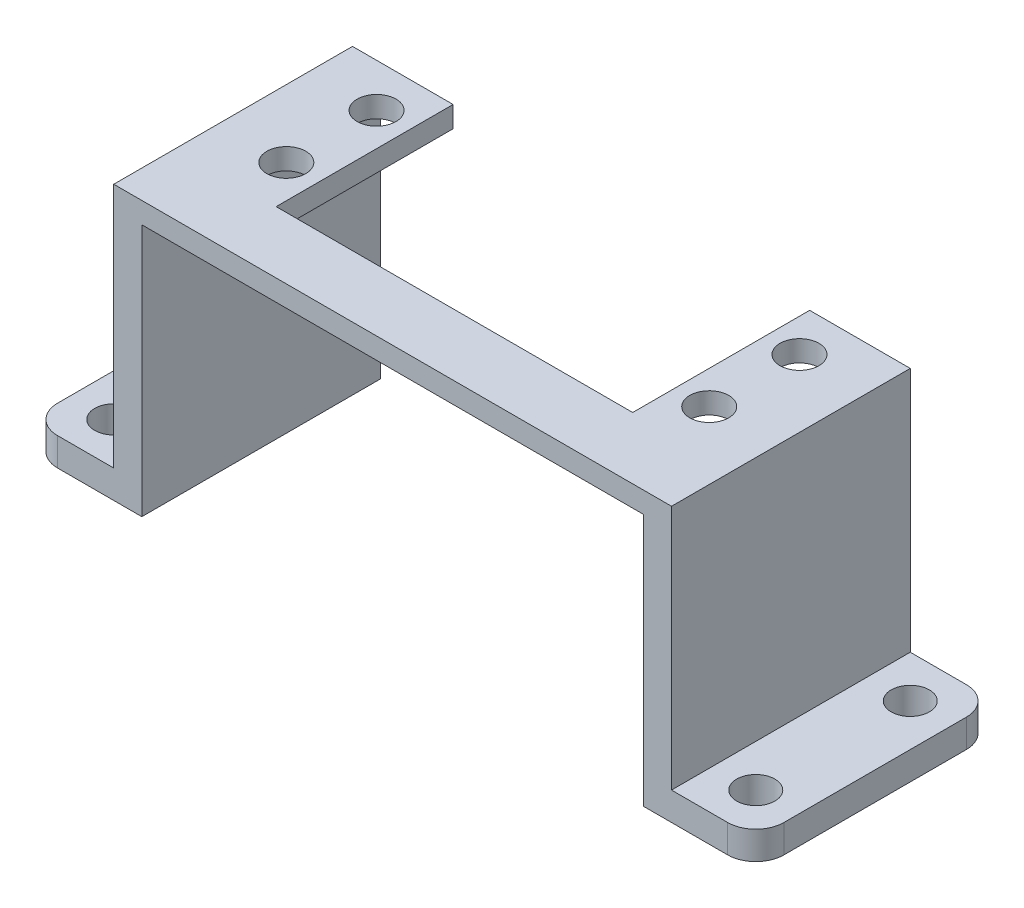
from build123d import *

# Parameters (mm, degrees)
SKETCH1_R           = 2.2
BOSS_EXTRUDE1_DEPTH = 2.38125
SKETCH2_W           = 3.175
SKETCH2_H           = 26.985
BOSS_EXTRUDE2_DEPTH = 28.575
SKETCH3_W           = 26.985
SKETCH3_H           = 3.175
BOSS_EXTRUDE3_DEPTH = 9.525
SKETCH4_W           = 26.985
SKETCH4_H           = 3.175
BOSS_EXTRUDE4_DEPTH = 9.525
FILLET1_R           = 3.175
SKETCH5_R           = 2.159
CUT_EXTRUDE1_DEPTH  = 3.175


with BuildPart() as part:
    # Sketch1 → Boss-Extrude1 (new body)
    with BuildSketch(Plane(origin=(0, 0, 0), x_dir=(1, 0, 0), z_dir=(0, 1, 0))):
        Polygon((20.15, 0), (-20.15, 0), (-20.15, 20), (-31.52, 20), (-31.52, -6.985), (31.52, -6.985), (31.52, 20), (20.15, 20), align=None)
        with Locations(Location((-23.9, 15.1, 0), (0, 0, 90))):
            Circle(SKETCH1_R, mode=Mode.SUBTRACT)
        with Locations(Location((-23.9, 4.9, 0), (0, 0, 90))):
            Circle(SKETCH1_R, mode=Mode.SUBTRACT)
        with Locations(Location((23.9, 4.9, 0), (0, 0, 90))):
            Circle(SKETCH1_R, mode=Mode.SUBTRACT)
        with Locations(Location((23.9, 15.1, 0), (0, 0, 90))):
            Circle(SKETCH1_R, mode=Mode.SUBTRACT)
    extrude(amount=BOSS_EXTRUDE1_DEPTH)

    # Sketch2 → Boss-Extrude2 (add)
    with BuildSketch(Plane.XZ):
        with Locations((29.9325, -6.5075)):
            Rectangle(SKETCH2_W, SKETCH2_H)
        with Locations((-29.9325, -6.5075)):
            Rectangle(SKETCH2_W, SKETCH2_H)
    extrude(amount=BOSS_EXTRUDE2_DEPTH)

    # Sketch3 → Boss-Extrude3 (add)
    with BuildSketch(Plane(origin=(31.52, 0, 0), x_dir=(0, 0, -1), z_dir=(1, 0, 0))):
        with Locations((6.5075, -26.9875)):
            Rectangle(SKETCH3_W, SKETCH3_H)
    extrude(amount=BOSS_EXTRUDE3_DEPTH)

    # Sketch4 → Boss-Extrude4 (add)
    with BuildSketch(Plane.ZY.offset(31.52)):
        with Locations((-6.5075, -26.9875)):
            Rectangle(SKETCH4_W, SKETCH4_H)
    extrude(amount=BOSS_EXTRUDE4_DEPTH)

    # Fillet1
    fillet1_edges = [part.edges().sort_by_distance(p)[0] for p in [
        (41.045, -26.9875, 6.985),
        (41.045, -26.9875, -20),
        (-41.045, -26.9875, -20),
        (-41.045, -26.9875, 6.985),
    ]]
    fillet(fillet1_edges, radius=FILLET1_R)

    # Sketch5 → Cut-Extrude1 (cut)
    with BuildSketch(Plane(origin=(0, -25.4, 0), x_dir=(1, 0, 0), z_dir=(0, 1, 0))):
        with Locations(Location((36.2825, -2.2225, 0), (0, 0, 270))):
            Circle(SKETCH5_R)
        with Locations(Location((36.2825, 15.2375, 0), (0, 0, 270))):
            Circle(SKETCH5_R)
        with Locations(Location((-36.2825, -2.2225, 0), (0, 0, 270))):
            Circle(SKETCH5_R)
        with Locations(Location((-36.2825, 15.2375, 0), (0, 0, 270))):
            Circle(SKETCH5_R)
    extrude(amount=-CUT_EXTRUDE1_DEPTH, mode=Mode.SUBTRACT)


solid = part.part
